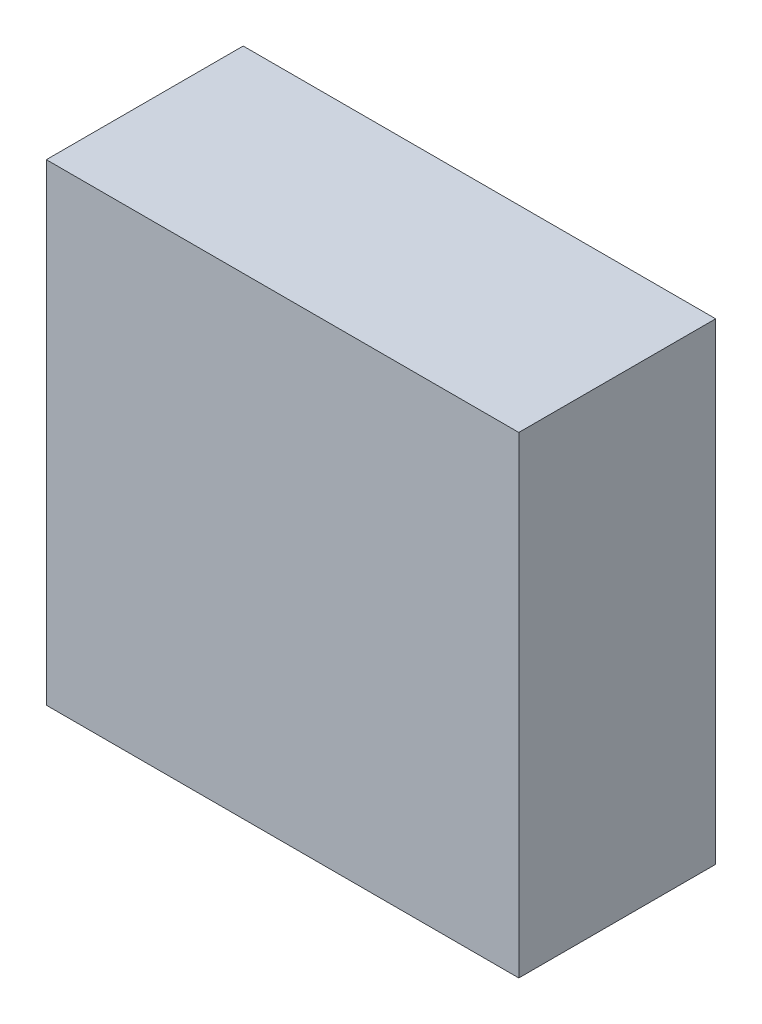
from build123d import *

# Parameters (mm, degrees)
SKETCH1_W           = 60
SKETCH1_H           = 60
BOSS_EXTRUDE1_DEPTH = 25


with BuildPart() as part:
    # Sketch1 → Boss-Extrude1 (new body)
    with BuildSketch(Plane.XY):
        with Locations((30, 30)):
            Rectangle(SKETCH1_W, SKETCH1_H)
    extrude(amount=BOSS_EXTRUDE1_DEPTH)


solid = part.part
